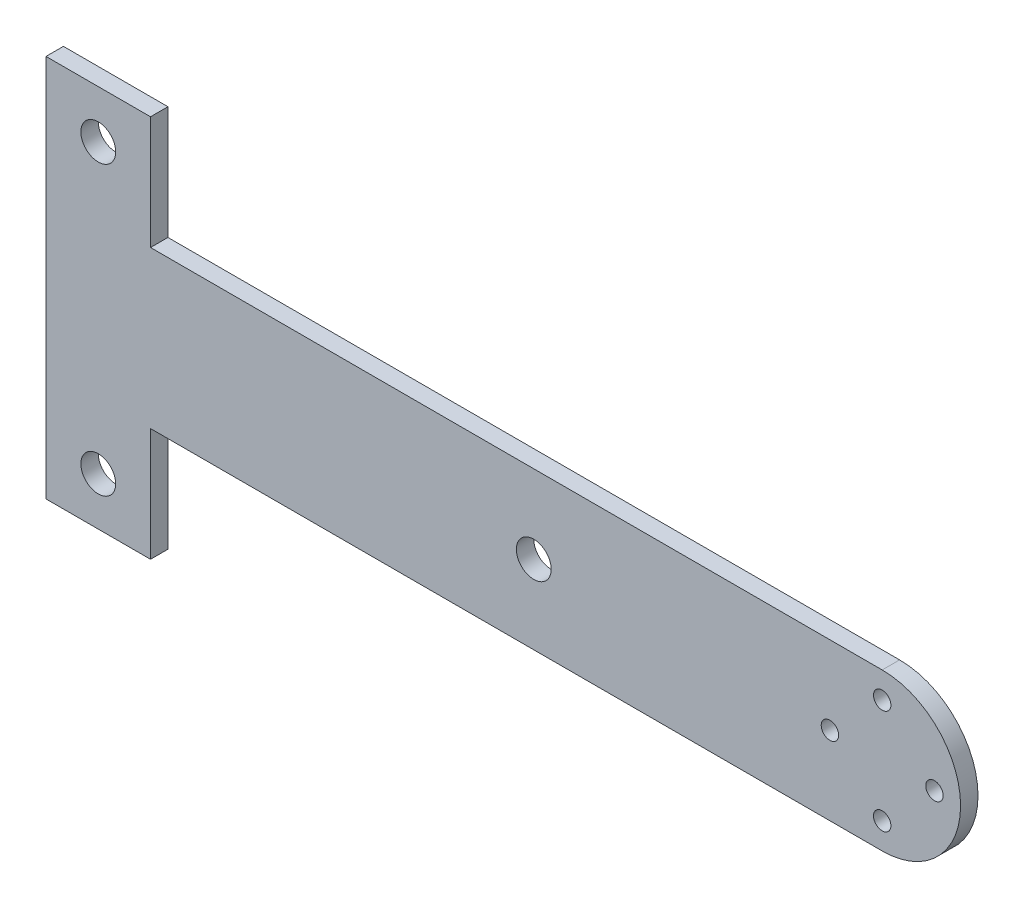
from build123d import *

# Parameters (mm, degrees)
SKETCH_1_R      = 2
SKETCH_1_R_2    = 1
EXTRUDE_1_DEPTH = 2


with BuildPart() as part:
    # 草图1 → 凸台-拉伸1 (new body)
    with BuildSketch(Plane.XY):
        with BuildLine():
            Line((41.276428571, -8.854285714), (-42.723571429, -8.854285714))
            Line((-42.723571429, -8.854285714), (-42.723571429, -21.854285714))
            Line((-42.723571429, -21.854285714), (-54.723571429, -21.854285714))
            Line((-54.723571429, -21.854285714), (-54.723571429, 22.145714286))
            Line((-54.723571429, 22.145714286), (-42.723571429, 22.145714286))
            Line((-42.723571429, 22.145714286), (-42.723571429, 9.145714286))
            Line((-42.723571429, 9.145714286), (41.276428571, 9.145714286))
            ThreePointArc((41.276428571, 9.145714286), (50.276428571, 0.145714286), (41.276428571, -8.854285714))
        make_face()
        with Locations((1.276428571, 0.145714286)):
            Circle(SKETCH_1_R, mode=Mode.SUBTRACT)
        with Locations((-48.723571429, 16.645714286)):
            Circle(SKETCH_1_R, mode=Mode.SUBTRACT)
        with Locations((-48.723571429, -16.354285714)):
            Circle(SKETCH_1_R, mode=Mode.SUBTRACT)
        with Locations((41.276428571, 6.145714286)):
            Circle(SKETCH_1_R_2, mode=Mode.SUBTRACT)
        with Locations((47.276428571, 0.145714286)):
            Circle(SKETCH_1_R_2, mode=Mode.SUBTRACT)
        with Locations((41.276428571, -5.854285714)):
            Circle(SKETCH_1_R_2, mode=Mode.SUBTRACT)
        with Locations((35.276428571, 0.145714286)):
            Circle(SKETCH_1_R_2, mode=Mode.SUBTRACT)
    extrude(amount=EXTRUDE_1_DEPTH)


solid = part.part
